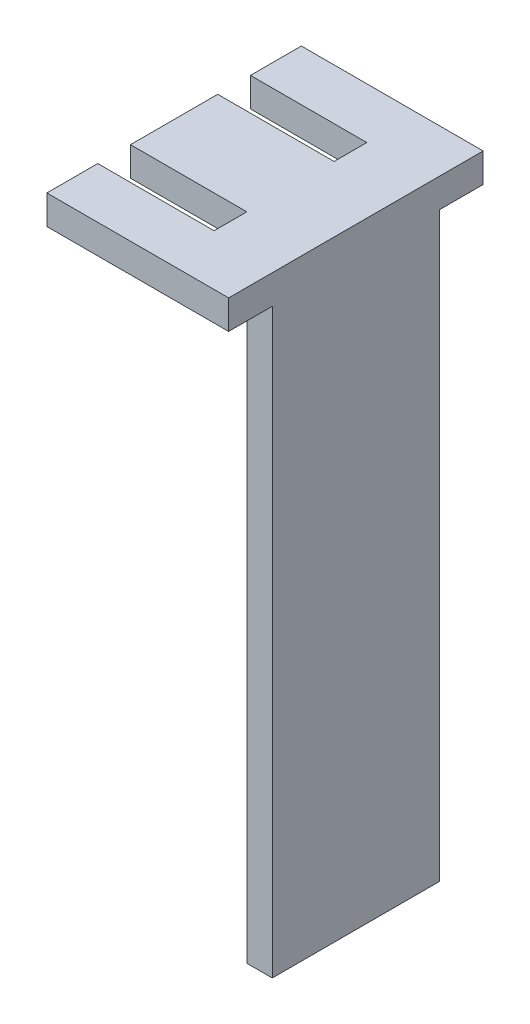
from build123d import *

# Parameters (mm, degrees)
SKETCH1_W           = 25
SKETCH1_H           = 35
BOSS_EXTRUDE1_DEPTH = 4
SKETCH2_W           = 16
SKETCH2_H           = 4.5
CUT_EXTRUDE1_DEPTH  = 4
SKETCH3_W           = 3.5
SKETCH3_H           = 23
BOSS_EXTRUDE2_DEPTH = 80


with BuildPart() as part:
    # Sketch1 → Boss-Extrude1 (new body)
    with BuildSketch(Plane(origin=(0, 0, 0), x_dir=(1, 0, 0), z_dir=(0, 1, 0))):
        with Locations((2.648305085, -4.841101695)):
            Rectangle(SKETCH1_W, SKETCH1_H)
    extrude(amount=BOSS_EXTRUDE1_DEPTH)

    # Sketch2 → Cut-Extrude1 (cut)
    with BuildSketch(Plane(origin=(0, 4, 0), x_dir=(1, 0, 0), z_dir=(0, 1, 0))):
        with Locations((-1.851694915, -13.091101695)):
            Rectangle(SKETCH2_W, SKETCH2_H)
        with Locations((-1.851694915, 3.408898305)):
            Rectangle(SKETCH2_W, SKETCH2_H)
    extrude(amount=-CUT_EXTRUDE1_DEPTH, mode=Mode.SUBTRACT)

    # Sketch3 → Boss-Extrude2 (add)
    with BuildSketch(Plane(origin=(0, 0, 0), x_dir=(-1, 0, 0), z_dir=(0, -1, 0))):
        with Locations((-13.398305085, -4.841101695)):
            Rectangle(SKETCH3_W, SKETCH3_H)
    extrude(amount=BOSS_EXTRUDE2_DEPTH)


solid = part.part
